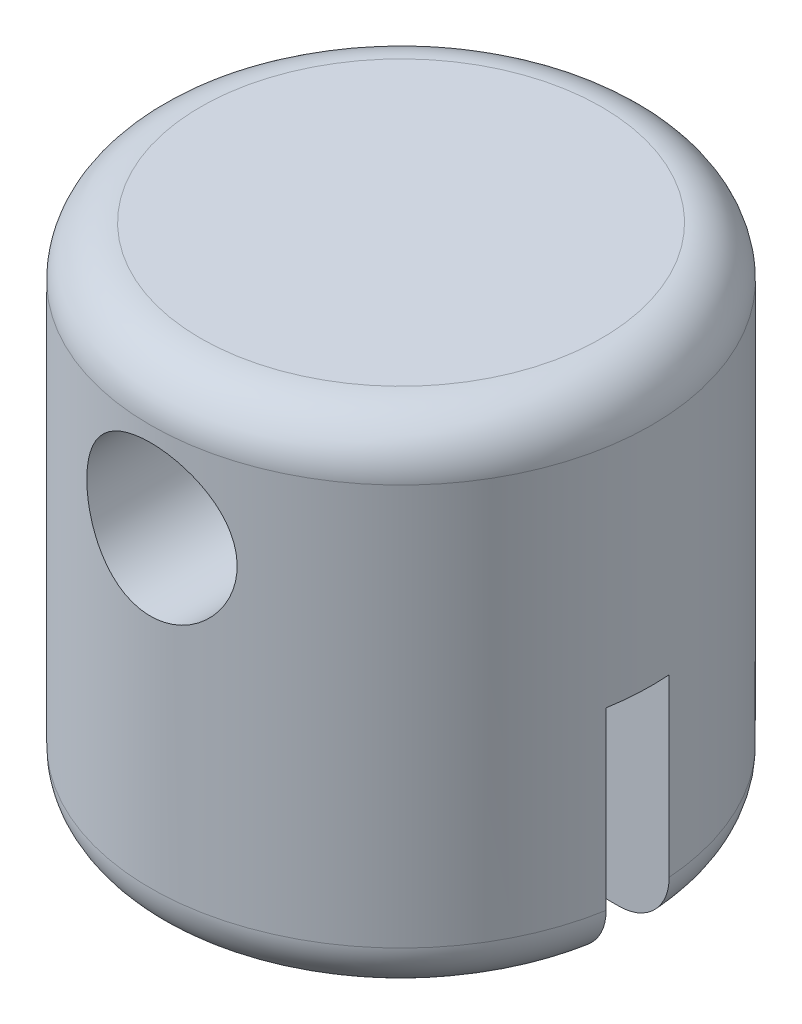
from build123d import *

# Parameters (mm, degrees)
SKETCH1_R           = 12.7
BOSS_EXTRUDE1_DEPTH = 25.4
SKETCH2_R           = 3.81
CUT_EXTRUDE1_DEPTH  = 25.4
SKETCH3_W           = 3.048
SKETCH3_H           = 11.43
CUT_EXTRUDE2_DEPTH  = 25.4
FILLET1_R           = 2.54


with BuildPart() as part:
    # Sketch1 → Boss-Extrude1 (new body)
    with BuildSketch(Plane(origin=(0, 0, 0), x_dir=(1, 0, 0), z_dir=(0, 1, 0))):
        with Locations(Location((0, 0, 0), (0, 0, 270))):
            Circle(SKETCH1_R)
    extrude(amount=BOSS_EXTRUDE1_DEPTH)

    # Sketch2 → Cut-Extrude1 (cut, symmetric)
    with BuildSketch(Plane.XY):
        with Locations(Location((0, 18.286129729, 0), (0, 0, 90.000000018))):
            Circle(SKETCH2_R)
    extrude(amount=CUT_EXTRUDE1_DEPTH, both=True, mode=Mode.SUBTRACT)

    # Sketch3 → Cut-Extrude2 (cut, symmetric)
    with BuildSketch(Plane(origin=(0, 0, 0), x_dir=(0, 0, -1), z_dir=(1, 0, 0))):
        with Locations((-0.60404942, 5.715)):
            Rectangle(SKETCH3_W, SKETCH3_H)
    extrude(amount=CUT_EXTRUDE2_DEPTH, both=True, mode=Mode.SUBTRACT)

    # Fillet1
    fillet1_edges = [part.edges().sort_by_distance(p)[0] for p in [
        (0, 0, -12.7),
        (8.193405042, 0, 9.703510386),
        (0, 25.4, -12.7),
    ]]
    fillet(fillet1_edges, radius=FILLET1_R)


solid = part.part
